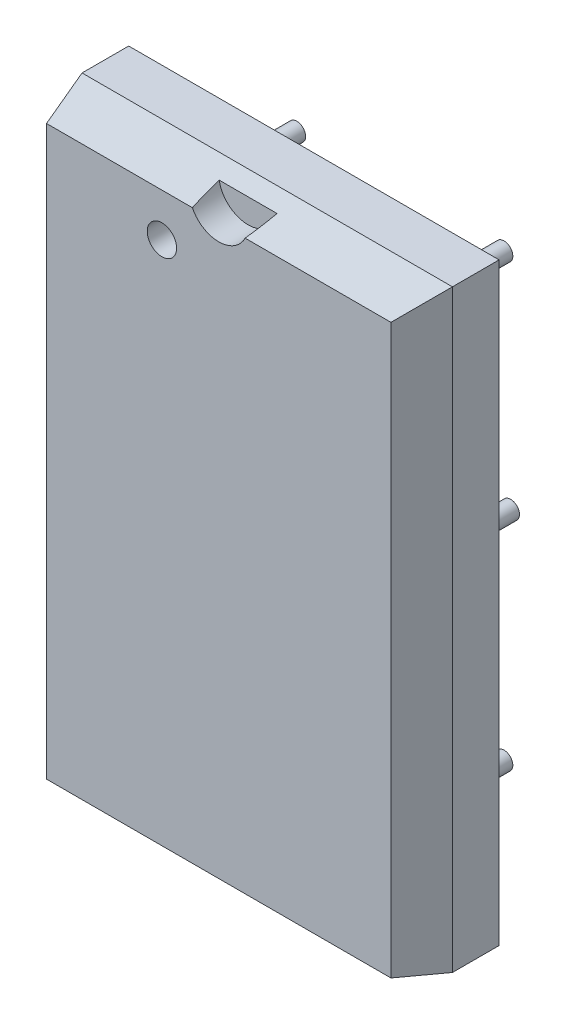
from build123d import *
from OCP.BRepFilletAPI import BRepFilletAPI_MakeChamfer

# Parameters (mm, degrees)
SKETCH_2_W          = 12.6
SKETCH_2_H          = 20.2
EXTRUDE_1_DEPTH     = 3.68
CHAMFER_1_SIZE      = 1.65
CHAMFER_1_SIZE2     = 0.442116168
SKETCH_6_R          = 1
SKETCH_6_R_2        = 0.5
CUT_EXTRUDE_1_DEPTH = 1
SKETCH_7_R          = 0.3
EXTRUDE_2_DEPTH     = 2.5


with BuildPart() as part:
    # Эскиз2 → Вытянуть1 (new body)
    with BuildSketch(Plane.XY.offset(4.32)):
        with Locations((4.13, -7.62)):
            Rectangle(SKETCH_2_W, SKETCH_2_H)
    extrude(amount=-EXTRUDE_1_DEPTH)

    # Фаска1: one chamfer whose edges measure the first distance from different faces: ONE call of the kernel's chamfer builder (chamfer() names one face for all edges)
    chamfer_1_edges_1 = [part.edges().sort_by_distance(p)[0] for p in [
        (10.43, -7.62, 0.64),
        (4.13, 2.48, 0.64),
        (-2.17, -7.62, 0.64),
        (4.13, -17.72, 0.64),
    ]]
    chamfer_1_side_1 = [part.faces().sort_by_distance(p)[0] for p in [
        (4.13, -7.62, 0.64),
    ]]
    chamfer_1_edges_2 = [part.edges().sort_by_distance(p)[0] for p in [
        (4.13, 2.48, 4.32),
    ]]
    chamfer_1_side_2 = [part.faces().sort_by_distance(p)[0] for p in [
        (4.13, 2.48, 2.48),
    ]]
    chamfer_1_edges_3 = [part.edges().sort_by_distance(p)[0] for p in [
        (10.43, -7.62, 4.32),
    ]]
    chamfer_1_side_3 = [part.faces().sort_by_distance(p)[0] for p in [
        (10.43, -7.62, 2.48),
    ]]
    chamfer_1_edges_4 = [part.edges().sort_by_distance(p)[0] for p in [
        (4.13, -17.72, 4.32),
    ]]
    chamfer_1_side_4 = [part.faces().sort_by_distance(p)[0] for p in [
        (4.13, -17.72, 2.48),
    ]]
    chamfer_1_edges_5 = [part.edges().sort_by_distance(p)[0] for p in [
        (-2.17, -7.62, 4.32),
    ]]
    chamfer_1_side_5 = [part.faces().sort_by_distance(p)[0] for p in [
        (-2.17, -7.62, 2.48),
    ]]
    chamfer_1 = BRepFilletAPI_MakeChamfer(part.part.solid().wrapped)
    for e in chamfer_1_edges_1:
        chamfer_1.Add(CHAMFER_1_SIZE, CHAMFER_1_SIZE2, e.wrapped, chamfer_1_side_1[0].wrapped)  # the first distance lies on this face
    for e in chamfer_1_edges_2:
        chamfer_1.Add(CHAMFER_1_SIZE, CHAMFER_1_SIZE2, e.wrapped, chamfer_1_side_2[0].wrapped)  # the first distance lies on this face
    for e in chamfer_1_edges_3:
        chamfer_1.Add(CHAMFER_1_SIZE, CHAMFER_1_SIZE2, e.wrapped, chamfer_1_side_3[0].wrapped)  # the first distance lies on this face
    for e in chamfer_1_edges_4:
        chamfer_1.Add(CHAMFER_1_SIZE, CHAMFER_1_SIZE2, e.wrapped, chamfer_1_side_4[0].wrapped)  # the first distance lies on this face
    for e in chamfer_1_edges_5:
        chamfer_1.Add(CHAMFER_1_SIZE, CHAMFER_1_SIZE2, e.wrapped, chamfer_1_side_5[0].wrapped)  # the first distance lies on this face
    add(Compound.cast(chamfer_1.Shape()), mode=Mode.REPLACE)

    # Эскиз6 → Вырез-Вытянуть1 (cut)
    with BuildSketch(Plane.XY.offset(4.32)):
        with Locations((4.13, 2.48)):
            Circle(SKETCH_6_R)
        with Locations((2.197434959, 0.574075773)):
            Circle(SKETCH_6_R_2)
    extrude(amount=-CUT_EXTRUDE_1_DEPTH, mode=Mode.SUBTRACT)

    # Эскиз7 → Вытянуть2 (add)
    with BuildSketch(Plane(origin=(0, 0, 0.64), x_dir=(-1, 0, 0), z_dir=(0, 0, -1))):
        with Locations(Location((-7.88, -7.62, 0), (0, 0, 180))):
            Circle(SKETCH_7_R)
        with Locations(Location((-7.653482529, -0.12, 0), (0, 0, 180))):
            Circle(SKETCH_7_R)
        with Locations(Location((-7.653482529, -15.12, 0), (0, 0, 180))):
            Circle(SKETCH_7_R)
        with Locations(Location((-0.606517471, -15.12, 0), (0, 0, 180))):
            Circle(SKETCH_7_R)
        with Locations(Location((-0.606517471, -0.12, 0), (0, 0, 180))):
            Circle(SKETCH_7_R)
        with Locations(Location((-0.38, -7.62, 0), (0, 0, 180))):
            Circle(SKETCH_7_R)
    extrude(amount=EXTRUDE_2_DEPTH)


solid = part.part
